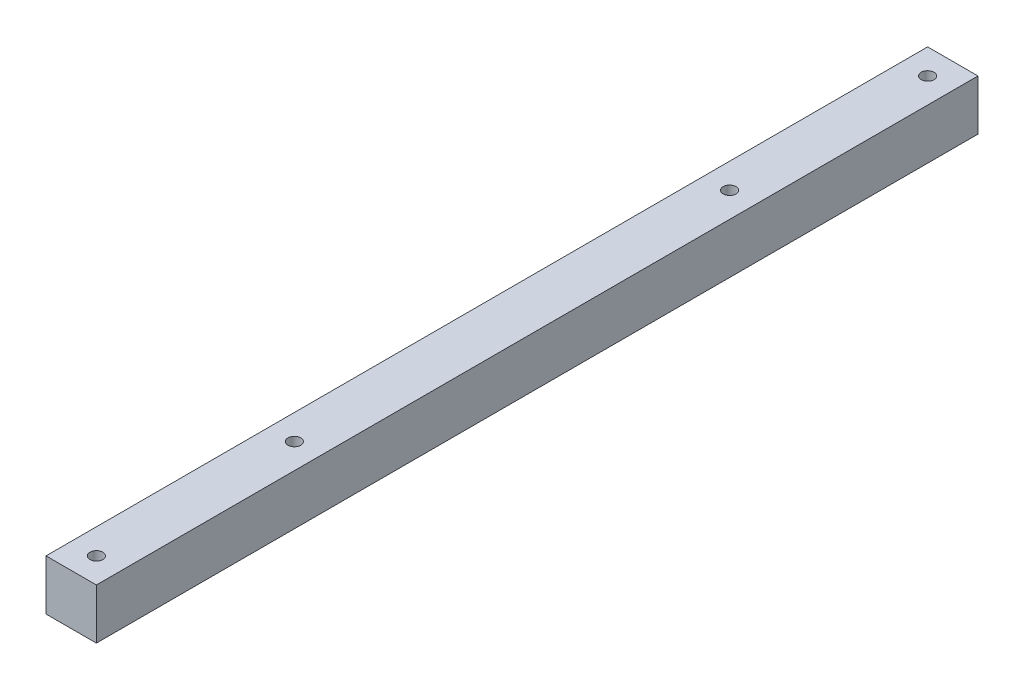
from build123d import *

# Parameters (mm, degrees)
SKETCH_1_W          = 20
SKETCH_1_H          = 20
EXTRUDE_1_DEPTH     = 350
SKETCH_2_R          = 2.55
CUT_EXTRUDE_1_DEPTH = 79


with BuildPart() as part:
    # 草图1 → 凸台-拉伸1 (new body)
    with BuildSketch(Plane.XY):
        with Locations((10, -10)):
            Rectangle(SKETCH_1_W, SKETCH_1_H)
    extrude(amount=EXTRUDE_1_DEPTH)

    # 草图2 → 切除-拉伸1 (cut)
    with BuildSketch(Plane(origin=(0, 0, 0), x_dir=(1, 0, 0), z_dir=(0, 1, 0))):
        with Locations(Location((10, -340, 0), (0, 0, 270))):
            Circle(SKETCH_2_R)
        with Locations(Location((10, -10, 0), (0, 0, 270))):
            Circle(SKETCH_2_R)
        with Locations(Location((10, -261.4, 0), (0, 0, 270))):
            Circle(SKETCH_2_R)
        with Locations(Location((10, -88.6, 0), (0, 0, 270))):
            Circle(SKETCH_2_R)
    extrude(amount=-CUT_EXTRUDE_1_DEPTH, mode=Mode.SUBTRACT)


solid = part.part
